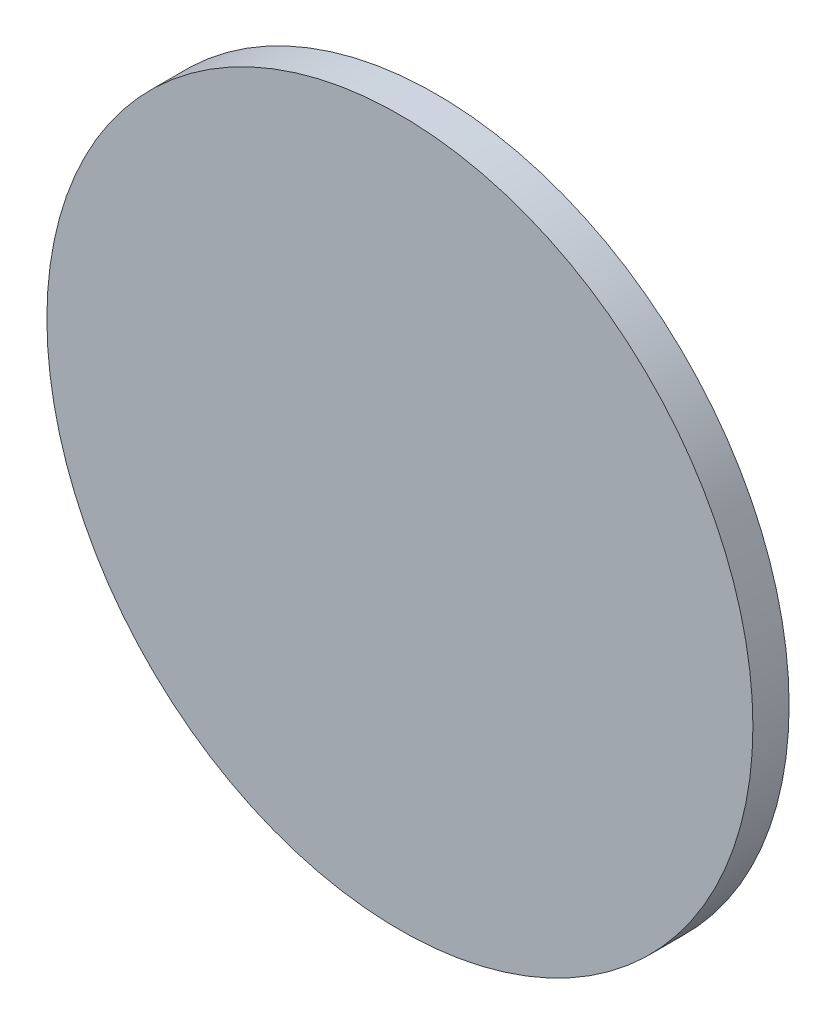
from build123d import *

# Parameters (mm, degrees)
SKETCH1_R           = 19.5
BOSS_EXTRUDE1_DEPTH = 2


with BuildPart() as part:
    # Sketch1 → Boss-Extrude1 (new body)
    with BuildSketch(Plane.XY):
        Circle(SKETCH1_R)
    extrude(amount=BOSS_EXTRUDE1_DEPTH)


solid = part.part
